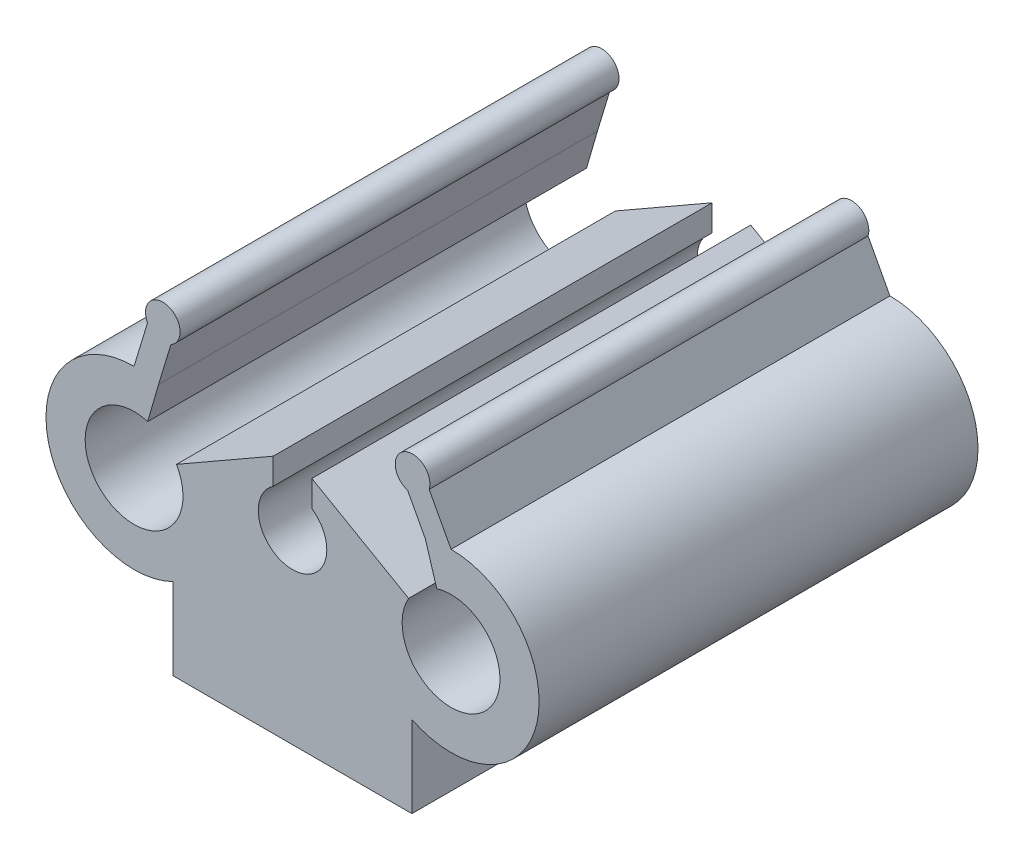
from build123d import *

# Parameters (mm, degrees)
Y_KSEKLIK_EKSTR_ZYON1_DEPTH = 22.43


with BuildPart() as part:
    # Çizim1 → Yükseklik-Ekstrüzyon1 (new body)
    with BuildSketch(Plane.XY):
        with BuildLine():
            ThreePointArc((5.113608786, 10.945521488), (6.1, 7.75), (7.086391214, 10.945521488))
            Line((7.086391214, 10.945521488), (7.086391214, 12.27879517))
            Line((7.086391214, 12.27879517), (10.2961903, 10.438363203))
            Line((10.2961903, 10.438363203), (12.031216834, 9.443535113))
            ThreePointArc((12.031216834, 9.443535113), (15.758549535, 6.245281773), (13.470670658, 10.591250449))
            Line((13.470670658, 10.591250449), (12.887207184, 12.504250808))
            Line((12.887207184, 12.504250808), (11.978588262, 14.203649507))
            ThreePointArc((11.978588262, 14.203649507), (11.817033945, 15.831345203), (13.080916647, 14.793032346))
            Line((13.080916647, 14.793032346), (14.2, 12.7))
            ThreePointArc((14.2, 12.7), (18.58121444, 7.172887527), (12.2, 4.168871126))
            Line((12.2, 4.168871126), (12.2, 0))
            Line((12.2, 0), (0, 0))
            Line((0, 0), (0, 4.168871126))
            ThreePointArc((0, 4.168871126), (-6.38121444, 7.172887527), (-2, 12.7))
            Line((-2, 12.7), (-1.311314062, 14.971308793))
            ThreePointArc((-1.311314062, 14.971308793), (-0.274595552, 16.23649961), (-0.115093584, 14.608601518))
            Line((-0.115093584, 14.608601518), (-0.747701793, 12.522238911))
            Line((-0.747701793, 12.522238911), (-1.304278774, 10.601243839))
            ThreePointArc((-1.304278774, 10.601243839), (-3.544803783, 6.234400531), (0.168783166, 9.443535113))
            Line((0.168783166, 9.443535113), (1.9038097, 10.438363203))
            Line((1.9038097, 10.438363203), (5.113608786, 12.27879517))
            Line((5.113608786, 12.27879517), (5.113608786, 10.945521488))
        make_face()
    extrude(amount=Y_KSEKLIK_EKSTR_ZYON1_DEPTH)


solid = part.part
